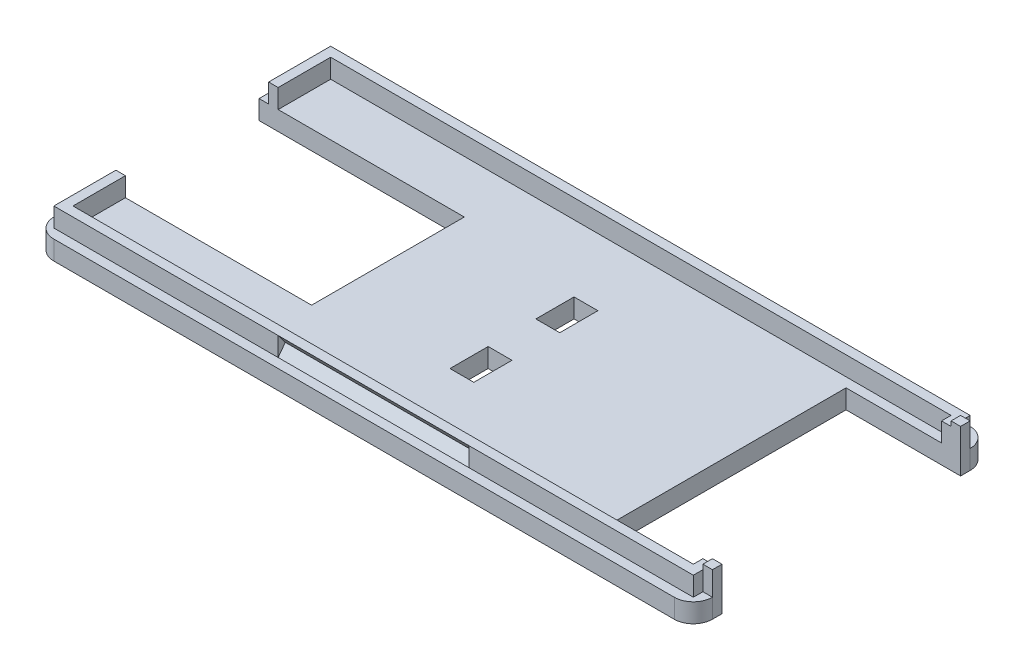
from build123d import *

# Parameters (mm, degrees)
BOSS_EXTRUDE1_DEPTH = 1
SKETCH3_W           = 67
SKETCH3_H           = 29
SKETCH3_W_2         = 65
SKETCH3_H_2         = 27
BOSS_EXTRUDE2_DEPTH = 2
CUT_EXTRUDE1_DEPTH  = 10
SKETCH7_W           = 21.5
SKETCH7_H           = 16
SKETCH7_W_2         = 12
SKETCH7_H_2         = 25
CUT_EXTRUDE2_DEPTH  = 20
SKETCH11_W          = 1
SKETCH11_H          = 1
BOSS_EXTRUDE5_DEPTH = 2.5
CUT_EXTRUDE3_DEPTH  = 0.5
SKETCH13_W          = 2.5
SKETCH13_H          = 4
CUT_EXTRUDE4_DEPTH  = 39.08871237


with BuildPart() as part:
    # Sketch1 → Boss-Extrude1 (new, symmetric)
    with BuildSketch(Plane(origin=(0, 0, 0), x_dir=(1, 0, 0), z_dir=(0, 1, 0))):
        with BuildLine():
            Line((-32.5, -15.5), (32.5, -15.5))
            ThreePointArc((32.5, -15.5), (33.914213562, -14.914213562), (34.5, -13.5))
            Line((34.5, -13.5), (34.5, 13.5))
            ThreePointArc((34.5, 13.5), (33.914213562, 14.914213562), (32.5, 15.5))
            Line((32.5, 15.5), (-32.5, 15.5))
            ThreePointArc((-32.5, 15.5), (-33.914213562, 14.914213562), (-34.5, 13.5))
            Line((-34.5, 13.5), (-34.5, -13.5))
            ThreePointArc((-34.5, -13.5), (-33.914213562, -14.914213562), (-32.5, -15.5))
        make_face()
    extrude(amount=BOSS_EXTRUDE1_DEPTH, both=True)

    # Sketch3 → Boss-Extrude2 (add)
    with BuildSketch(Plane(origin=(0, 1, 0), x_dir=(1, 0, 0), z_dir=(0, 1, 0))):
        Rectangle(SKETCH3_W, SKETCH3_H)
        Rectangle(SKETCH3_W_2, SKETCH3_H_2, mode=Mode.SUBTRACT)
    extrude(amount=BOSS_EXTRUDE2_DEPTH)

    # Sketch6 → Cut-Extrude1 (cut, symmetric)
    with BuildSketch(Plane(origin=(0, 0, 0), x_dir=(0, 0, -1), z_dir=(1, 0, 0))):
        Polygon((14.5, 1), (14.5, 3), (13.75, 2), align=None)
        Polygon((-13.75, 2), (-14.5, 1), (-14.5, 3), align=None)
    extrude(amount=CUT_EXTRUDE1_DEPTH, both=True, mode=Mode.SUBTRACT)

    # Sketch7 → Cut-Extrude2 (cut)
    with BuildSketch(Plane.XZ.offset(1)):
        with Locations((-23.75, 0)):
            Rectangle(SKETCH7_W, SKETCH7_H)
        with Locations((28.5, 0)):
            Rectangle(SKETCH7_W_2, SKETCH7_H_2)
    extrude(amount=-CUT_EXTRUDE2_DEPTH, mode=Mode.SUBTRACT)

    # Sketch11 → Boss-Extrude5 (add)
    with BuildSketch(Plane(origin=(0, 1, 0), x_dir=(1, 0, 0), z_dir=(0, 1, 0))):
        with Locations((34, 13)):
            Rectangle(SKETCH11_W, SKETCH11_H)
        with Locations((34, -13)):
            Rectangle(SKETCH11_W, SKETCH11_H)
    extrude(amount=BOSS_EXTRUDE5_DEPTH)

    # Sketch12 → Cut-Extrude3 (cut)
    with BuildSketch(Plane.XZ.offset(1)):
        Polygon((11.941533437, 6.065064103), (11.941533437, 9.484294872), (13.081277027, 9.484294872), (13.081277027, 8.344551282), (18.291533437, 8.344551282), (18.291533437, 7.204807692), (13.081277027, 7.204807692), (13.081277027, 6.065064103), align=None)
        Polygon((11.941533437, -4.884615385), (11.941533437, -3.667277644), (16.452170457, -2.03525641), (11.941533437, -0.399419071), (11.941533437, 0.814102564), (18.291533437, -1.48828125), (18.291533437, -2.586047676), align=None)
        with BuildLine():
            Line((13.043115969, -5.495192308), (13.84195411, -6.330919471))
            add(Edge.make_bspline(
                [(13.84195411, -6.330919471), (13.768637735, -6.401806055), (13.625427884, -6.540269761), (13.436040425, -6.763499644), (13.277548365, -6.995057512), (13.146745209, -7.232632751), (13.043791904, -7.47669033), (12.970992617, -7.72804876), (12.926114938, -7.986340764), (12.921019422, -8.161199427), (12.918456514, -8.249148638)],
                knots=[0, 0, 0, 0, 1.115315123, 2.178559852, 3.196385012, 4.180486591, 5.141138664, 6.08807191, 7.038351522, 8, 8, 8, 8], degree=3))
            add(Edge.make_bspline(
                [(12.918456514, -8.249148638), (12.920487286, -8.322594137), (12.92449479, -8.467530739), (12.953944547, -8.680315542), (13.00383624, -8.883932376), (13.07318533, -9.078542785), (13.160519089, -9.265108945), (13.270291327, -9.441893594), (13.398838264, -9.609846789), (13.545934957, -9.767006139), (13.707838119, -9.908887036), (13.878351171, -10.03672374), (14.060490077, -10.142609994), (14.251598692, -10.229044823), (14.451746028, -10.297157456), (14.660922066, -10.345499724), (14.879599088, -10.373509267), (15.028259493, -10.377685306), (15.103813085, -10.379807692)],
                knots=[0, 0, 0, 0, 1.035268443, 2.04298821, 3.02163646, 3.985902049, 4.951223231, 5.920091634, 6.913651787, 7.92868536, 8.949353712, 9.945284791, 10.92850487, 11.913014323, 12.897904816, 13.904240668, 14.934873455, 16, 16, 16, 16], degree=3))
            add(Edge.make_bspline(
                [(15.103813085, -10.379807692), (15.156840057, -10.379186533), (15.261357308, -10.377962216), (15.415574733, -10.364925614), (15.565507754, -10.343215337), (15.710796025, -10.312972773), (15.851629254, -10.274204313), (15.988337217, -10.229420059), (16.119289945, -10.172219135), (16.24693936, -10.109298874), (16.368212678, -10.036911087), (16.483189742, -9.95764624), (16.591896287, -9.872234836), (16.693945792, -9.779536195), (16.787869185, -9.678383039), (16.876223869, -9.571218373), (16.957616144, -9.456977598), (17.030749894, -9.335614926), (17.098918302, -9.210802926), (17.155368302, -9.07997032), (17.206114124, -8.94677674), (17.244290102, -8.808884538), (17.277495177, -8.66872294), (17.29777454, -8.524340956), (17.313184177, -8.377108845), (17.31413292, -8.277600269), (17.31461036, -8.227524038)],
                knots=[0, 0, 0, 0, 1.103738238, 2.175490744, 3.219137561, 4.256155604, 5.262629953, 6.259184223, 7.247888397, 8.234817694, 9.220364322, 10.185094651, 11.140491148, 12.096499151, 13.05201798, 14.011605636, 14.986460005, 15.968997565, 16.960259839, 17.944382265, 18.933125845, 19.924977513, 20.920749559, 21.929466621, 22.958034467, 24, 24, 24, 24], degree=3))
            add(Edge.make_bspline(
                [(17.31461036, -8.227524038), (17.312162797, -8.142583361), (17.307353971, -7.975697017), (17.269475061, -7.730825721), (17.207829637, -7.497111584), (17.132929858, -7.311049721), (17.060303901, -7.165191721), (16.995016409, -7.053220916), (16.919750327, -6.938662767), (16.834193119, -6.821691737), (16.738718629, -6.701628906), (16.631461316, -6.58046115), (16.51588805, -6.45512538), (16.43340391, -6.373017633), (16.391112764, -6.330919471)],
                knots=[0, 0, 0, 0, 1.404693586, 2.759857621, 4.088769373, 5.395275838, 6.0697462, 6.783214465, 7.53810233, 8.336454657, 9.18000028, 10.074808326, 11.012918585, 12, 12, 12, 12], degree=3))
            Line((16.391112764, -6.330919471), (17.242104351, -5.520633013))
            add(Edge.make_bspline(
                [(17.242104351, -5.520633013), (17.297096261, -5.577591789), (17.404428711, -5.68876314), (17.556830773, -5.856462037), (17.693780967, -6.023949878), (17.820249986, -6.187180506), (17.93255348, -6.348827808), (18.030803608, -6.508874644), (18.117485256, -6.665509211), (18.191136583, -6.821984078), (18.253674209, -6.979272912), (18.307515, -7.141104638), (18.353062372, -7.307973991), (18.38981312, -7.480900133), (18.419282258, -7.658270114), (18.439173756, -7.841743881), (18.452546148, -8.030158121), (18.453747768, -8.157962419), (18.45435395, -8.222435897)],
                knots=[0, 0, 0, 0, 1.244526981, 2.429050516, 3.560637417, 4.644440555, 5.67424972, 6.652764056, 7.595344123, 8.486817594, 9.369275933, 10.254498637, 11.166417451, 12.086725134, 13.032340136, 13.991389299, 14.986715468, 16, 16, 16, 16], degree=3))
            add(Edge.make_bspline(
                [(18.45435395, -8.222435897), (18.451334939, -8.340865691), (18.445427572, -8.572599876), (18.401657986, -8.912200283), (18.328279045, -9.234811554), (18.224500984, -9.541218541), (18.091929374, -9.831323814), (17.929402805, -10.105053156), (17.737353086, -10.361965375), (17.518031224, -10.599985126), (17.275808639, -10.815285319), (17.015728035, -11.005585757), (16.736511209, -11.163002287), (16.442283088, -11.293708623), (16.131700993, -11.395919259), (15.804428969, -11.467858219), (15.460783018, -11.51222245), (15.226064912, -11.51707596), (15.106357155, -11.519551282)],
                knots=[0, 0, 0, 0, 1.078019885, 2.10938526, 3.111377082, 4.085535484, 5.04941344, 6.010039228, 6.978205633, 7.964457913, 8.951525778, 9.924444315, 10.892603023, 11.863865945, 12.85144698, 13.863884204, 14.910567087, 16, 16, 16, 16], degree=3))
            add(Edge.make_bspline(
                [(15.106357155, -11.519551282), (15.028282903, -11.518515641), (14.873558818, -11.516463254), (14.645252317, -11.494488037), (14.422973185, -11.464639878), (14.208620877, -11.415608228), (13.999755502, -11.358606766), (13.798225395, -11.285168838), (13.603181636, -11.199848512), (13.414870564, -11.102428539), (13.235325687, -10.990848613), (13.063401988, -10.869367728), (12.901326556, -10.735039657), (12.748431173, -10.589223971), (12.602984036, -10.433268126), (12.468562175, -10.264501174), (12.341559366, -10.085801372), (12.225763331, -9.895930835), (12.120448829, -9.699216136), (12.029843958, -9.496613136), (11.952101659, -9.290733703), (11.888096138, -9.080953584), (11.840190071, -8.866901839), (11.803961981, -8.650012752), (11.783702598, -8.428465968), (11.780386745, -8.279715595), (11.778712925, -8.204627404)],
                knots=[0, 0, 0, 0, 1.071814294, 2.12407397, 3.147667899, 4.14936388, 5.141177959, 6.119239245, 7.091825145, 8.063277363, 9.028022524, 9.992609517, 10.952139039, 11.915934802, 12.892469547, 13.878248468, 14.87668965, 15.901326483, 16.93027266, 17.938917451, 18.9468897, 19.950817235, 20.948103127, 21.957084021, 22.968749718, 24, 24, 24, 24], degree=3))
            add(Edge.make_bspline(
                [(11.778712925, -8.204627404), (11.779673395, -8.140569838), (11.781584349, -8.013120728), (11.797486076, -7.823322383), (11.822530484, -7.635062735), (11.860053114, -7.448916668), (11.905494747, -7.264047093), (11.961466571, -7.081228011), (12.029739078, -6.900963551), (12.105262879, -6.721690962), (12.191242805, -6.546985568), (12.287480484, -6.37836568), (12.391458247, -6.215413485), (12.504964528, -6.059111316), (12.626332067, -5.908358268), (12.755556847, -5.763315194), (12.894982972, -5.625373889), (12.993488679, -5.538805542), (13.043115969, -5.495192308)],
                knots=[0, 0, 0, 0, 0.996333415, 1.982307736, 2.96084097, 3.949129141, 4.93457382, 5.921430247, 6.92116383, 7.931890485, 8.946633814, 9.948019707, 10.950686436, 11.952094051, 12.951305284, 13.960287133, 14.972390273, 16, 16, 16, 16], degree=3))
        make_face()
    extrude(amount=-CUT_EXTRUDE3_DEPTH, mode=Mode.SUBTRACT)

    # Sketch13 → Cut-Extrude4 (cut, through all)
    with BuildSketch(Plane.XZ.offset(1)):
        with Locations((1.25, 4.5)):
            Rectangle(SKETCH13_W, SKETCH13_H)
        with Locations((1.25, -4.5)):
            Rectangle(SKETCH13_W, SKETCH13_H)
    extrude(amount=-CUT_EXTRUDE4_DEPTH, mode=Mode.SUBTRACT)


solid = part.part
